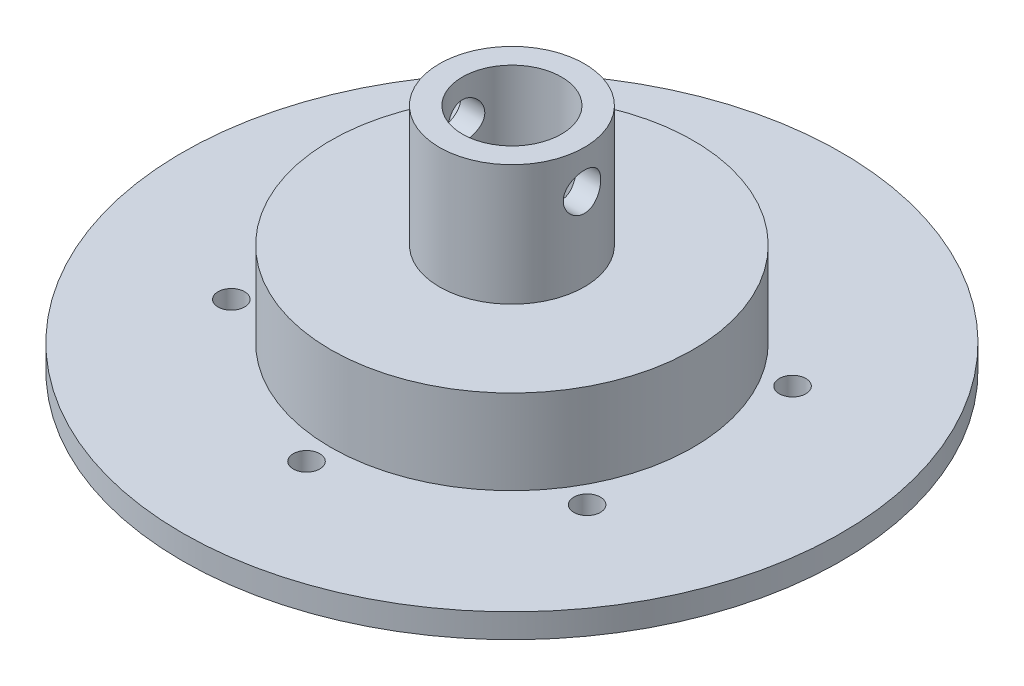
from build123d import *

# Parameters (mm, degrees)
SKETCH1_R               = 27.274244274
SKETCH1_R_2             = 12.5
BOSS_EXTRUDE1_DEPTH     = 2
SKETCH4_R               = 15
BOSS_EXTRUDE3_DEPTH     = 7
SKETCH5_R               = 6
SKETCH5_R_2             = 4.1
BOSS_EXTRUDE4_DEPTH     = 10
CUT_EXTRUDE1_DEPTH      = 43.997311561
CUT_EXTRUDE1_DEPTH_BACK = 43.997311561
SKETCH6_R               = 1.55
SKETCH7_R               = 7.5
CUT_EXTRUDE2_DEPTH      = 5
CUT_EXTRUDE3_DEPTH      = 43.151735491
CUT_EXTRUDE3_DEPTH_BACK = 43.151735491
SKETCH9_R               = 1.1


with BuildPart() as part:
    # Sketch1 → Boss-Extrude1 (new body)
    with BuildSketch(Plane(origin=(0, 0, 0), x_dir=(1, 0, 0), z_dir=(0, 1, 0))):
        with Locations(Location((0, 0, 0), (0, 0, 270))):
            Circle(SKETCH1_R)
        with Locations(Location((0, 0, 0), (0, 0, 270))):
            Circle(SKETCH1_R_2, mode=Mode.SUBTRACT)
    extrude(amount=BOSS_EXTRUDE1_DEPTH)

    # Sketch4 → Boss-Extrude3 (add)
    with BuildSketch(Plane(origin=(0, 2, 0), x_dir=(1, 0, 0), z_dir=(0, 1, 0))):
        with Locations(Location((0, 0, 0), (0, 0, 270))):
            Circle(SKETCH4_R)
    extrude(amount=BOSS_EXTRUDE3_DEPTH)

    # Sketch5 → Boss-Extrude4 (add)
    with BuildSketch(Plane(origin=(0, 9, 0), x_dir=(1, 0, 0), z_dir=(0, 1, 0))):
        with Locations(Location((0, 0, 0), (0, 0, 270))):
            Circle(SKETCH5_R)
        with Locations(Location((0, 0, 0), (0, 0, 270))):
            Circle(SKETCH5_R_2, mode=Mode.SUBTRACT)
    extrude(amount=BOSS_EXTRUDE4_DEPTH)

    # Sketch6 → Cut-Extrude1 (cut, two sides: drawn at the far end of the back side and taken through both)
    with BuildSketch(Plane(origin=(0, 0, 0), x_dir=(0, 0, -1), z_dir=(1, 0, 0)).offset(-CUT_EXTRUDE1_DEPTH_BACK)):
        with Locations((0, 15.818596456)):
            Circle(SKETCH6_R)
    extrude(amount=CUT_EXTRUDE1_DEPTH + CUT_EXTRUDE1_DEPTH_BACK, mode=Mode.SUBTRACT)

    # Sketch7 → Cut-Extrude2 (cut)
    with BuildSketch(Plane.XZ.offset(-2)):
        with Locations(Location((0, 0, 0), (0, 0, 270))):
            Circle(SKETCH7_R)
    extrude(amount=-CUT_EXTRUDE2_DEPTH, mode=Mode.SUBTRACT)

    # Sketch9 → Cut-Extrude3 (cut, two sides: drawn at the far end of the back side and taken through both)
    with BuildSketch(Plane(origin=(0, 2, 0), x_dir=(1, 0, 0), z_dir=(0, 1, 0)).offset(-CUT_EXTRUDE3_DEPTH_BACK)):
        with Locations(Location((0, 17, 0), (0, 0, 270))):
            Circle(SKETCH9_R)
        with Locations(Location((14.722431864, 8.5, 0), (0, 0, 270))):
            Circle(SKETCH9_R)
        with Locations(Location((14.722431864, -8.5, 0), (0, 0, 270))):
            Circle(SKETCH9_R)
        with Locations(Location((0, -17, 0), (0, 0, 270))):
            Circle(SKETCH9_R)
        with Locations(Location((-14.722431864, -8.5, 0), (0, 0, 270))):
            Circle(SKETCH9_R)
        with Locations(Location((-14.722431864, 8.5, 0), (0, 0, 270))):
            Circle(SKETCH9_R)
    extrude(amount=CUT_EXTRUDE3_DEPTH + CUT_EXTRUDE3_DEPTH_BACK, mode=Mode.SUBTRACT)


solid = part.part
